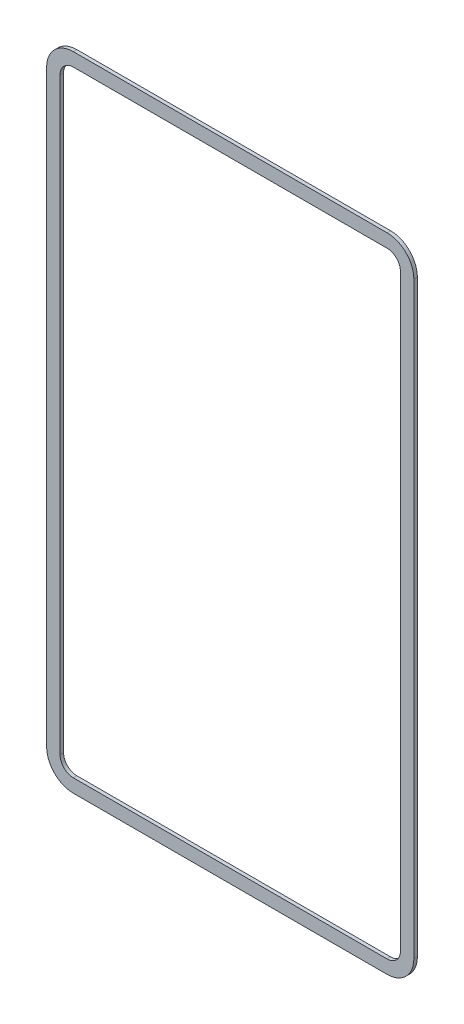
from build123d import *

# Parameters (mm, degrees)
BOSS_EXTRUDE1_DEPTH = 0.5


with BuildPart() as part:
    # Sketch1 → Boss-Extrude1 (new body)
    with BuildSketch(Plane.XY):
        with BuildLine():
            Line((-94.038111231, 56.520344688), (-49.496194956, 56.520344688))
            ThreePointArc((-49.496194956, 56.520344688), (-46.809189188, 55.407350457), (-45.696194956, 52.720344688))
            Line((-45.696194956, 52.720344688), (-45.696194956, -30.879655312))
            ThreePointArc((-45.696194956, -30.879655312), (-46.809189188, -33.56666108), (-49.496194956, -34.679655312))
            Line((-49.496194956, -34.679655312), (-94.038111231, -34.679655312))
            ThreePointArc((-94.038111231, -34.679655312), (-96.725116999, -33.56666108), (-97.838111231, -30.879655312))
            Line((-97.838111231, -30.879655312), (-97.838111231, 52.720344688))
            ThreePointArc((-97.838111231, 52.720344688), (-96.725116999, 55.407350457), (-94.038111231, 56.520344688))
        make_face()
        with BuildLine():
            Line((-95.938111231, 52.720344688), (-95.938111231, -30.879655312))
            ThreePointArc((-95.938111231, -30.879655312), (-95.381614115, -32.223158196), (-94.038111231, -32.779655312))
            Line((-94.038111231, -32.779655312), (-49.496194956, -32.779655312))
            ThreePointArc((-49.496194956, -32.779655312), (-48.152692072, -32.223158196), (-47.596194956, -30.879655312))
            Line((-47.596194956, -30.879655312), (-47.596194956, 52.720344688))
            ThreePointArc((-47.596194956, 52.720344688), (-48.152692072, 54.063847573), (-49.496194956, 54.620344688))
            Line((-49.496194956, 54.620344688), (-94.038111231, 54.620344688))
            ThreePointArc((-94.038111231, 54.620344688), (-95.381614115, 54.063847573), (-95.938111231, 52.720344688))
        make_face(mode=Mode.SUBTRACT)
    extrude(amount=BOSS_EXTRUDE1_DEPTH)


solid = part.part
